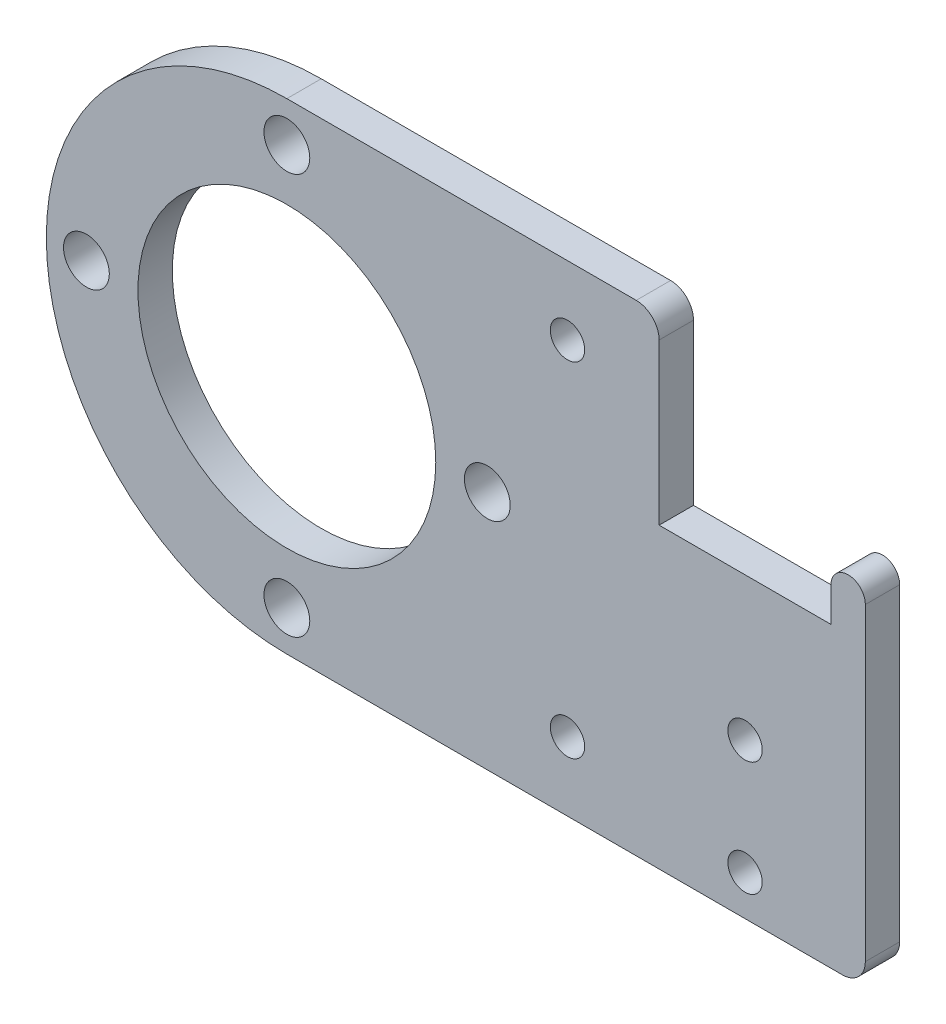
from build123d import *

# Parameters (mm, degrees)
SKETCH_1_R      = 13
SKETCH_1_R_2    = 2
SKETCH_1_R_3    = 1.5
EXTRUDE_1_DEPTH = 3
FILLET_1_R      = 2


with BuildPart() as part:
    # 草图1 → 凸台-拉伸1 (new body)
    with BuildSketch(Plane.XY):
        with BuildLine():
            Line((0, 21), (32.5, 21))
            Line((32.5, 21), (32.5, 5))
            Line((32.5, 5), (47.5, 5))
            Line((47.5, 5), (47.5, 8))
            ThreePointArc((47.5, 8), (49, 9.5), (50.5, 8))
            Line((50.5, 8), (50.5, -21))
            Line((50.5, -21), (0, -21))
            ThreePointArc((0, -21), (-21, 0), (0, 21))
        make_face()
        Circle(SKETCH_1_R, mode=Mode.SUBTRACT)
        with Locations((17.5, 0)):
            Circle(SKETCH_1_R_2, mode=Mode.SUBTRACT)
        with Locations((0, -17.5)):
            Circle(SKETCH_1_R_2, mode=Mode.SUBTRACT)
        with Locations((-17.5, 0)):
            Circle(SKETCH_1_R_2, mode=Mode.SUBTRACT)
        with Locations((0, 17.5)):
            Circle(SKETCH_1_R_2, mode=Mode.SUBTRACT)
        with Locations((40, -7.5)):
            Circle(SKETCH_1_R_3, mode=Mode.SUBTRACT)
        with Locations((40, -17.5)):
            Circle(SKETCH_1_R_3, mode=Mode.SUBTRACT)
        with Locations((24.5, 15)):
            Circle(SKETCH_1_R_3, mode=Mode.SUBTRACT)
        with Locations((24.5, -15)):
            Circle(SKETCH_1_R_3, mode=Mode.SUBTRACT)
    extrude(amount=EXTRUDE_1_DEPTH)

    # 圆角1
    fillet_1_edges = [part.edges().sort_by_distance(p)[0] for p in [
        (32.5, 21, 1.5),
        (50.5, -21, 1.5),
    ]]
    fillet(fillet_1_edges, radius=FILLET_1_R)


solid = part.part
